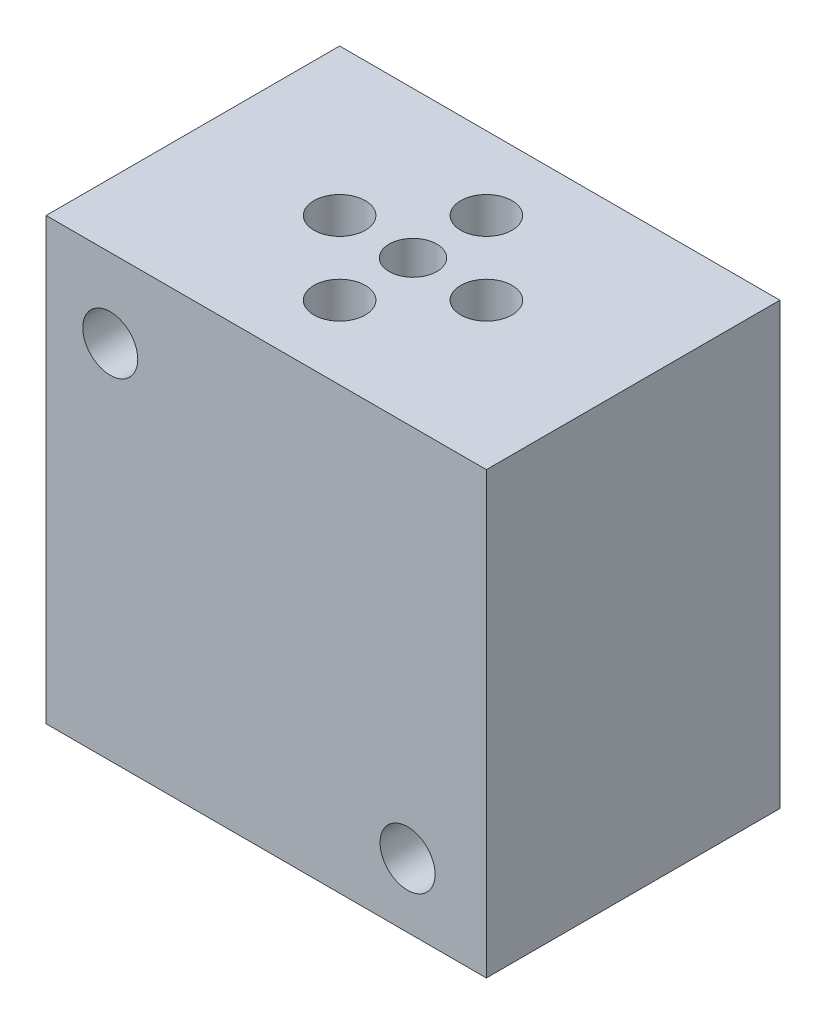
from build123d import *

# Parameters (mm, degrees)
SKETCH3_W           = 76.2
SKETCH3_H           = 50.8
BOSS_EXTRUDE1_DEPTH = 76.2
SKETCH5_R           = 4.1275
CUT_EXTRUDE1_DEPTH  = 76.2
SKETCH6_R           = 4.445
CUT_EXTRUDE2_DEPTH  = 76.2
SKETCH8_R           = 4.445
CUT_EXTRUDE4_DEPTH  = 76.2
SKETCH9_R           = 4.445
CUT_EXTRUDE5_DEPTH  = 76.2
SKETCH10_R          = 4.445
CUT_EXTRUDE6_DEPTH  = 76.2
SKETCH12_R          = 4.7625
CUT_EXTRUDE7_DEPTH  = 76.2
SKETCH13_R          = 4.7625
CUT_EXTRUDE8_DEPTH  = 76.2


with BuildPart() as part:
    # Sketch3 → Boss-Extrude1 (new body)
    with BuildSketch(Plane(origin=(0, 0, 0), x_dir=(1, 0, 0), z_dir=(0, 1, 0))):
        with Locations((-2.241176471, -1.805392157)):
            Rectangle(SKETCH3_W, SKETCH3_H)
    extrude(amount=BOSS_EXTRUDE1_DEPTH)

    # Sketch5 → Cut-Extrude1 (cut)
    with BuildSketch(Plane(origin=(0, 76.2, 0), x_dir=(1, 0, 0), z_dir=(0, 1, 0))):
        with Locations(Location((-2.241176471, -1.805392157, 0), (0, 0, 270))):
            Circle(SKETCH5_R)
    extrude(amount=-CUT_EXTRUDE1_DEPTH, mode=Mode.SUBTRACT)

    # Sketch6 → Cut-Extrude2 (cut)
    with BuildSketch(Plane(origin=(0, 76.2, 0), x_dir=(1, 0, 0), z_dir=(0, 1, 0))):
        with Locations(Location((-14.941176471, -1.805392157, 0), (0, 0, 270))):
            Circle(SKETCH6_R)
    extrude(amount=-CUT_EXTRUDE2_DEPTH, mode=Mode.SUBTRACT)

    # Sketch8 → Cut-Extrude4 (cut)
    with BuildSketch(Plane(origin=(0, 76.2, 0), x_dir=(1, 0, 0), z_dir=(0, 1, 0))):
        with Locations(Location((10.458823529, -1.805392157, 0), (0, 0, 270))):
            Circle(SKETCH8_R)
    extrude(amount=-CUT_EXTRUDE4_DEPTH, mode=Mode.SUBTRACT)

    # Sketch9 → Cut-Extrude5 (cut)
    with BuildSketch(Plane(origin=(0, 76.2, 0), x_dir=(1, 0, 0), z_dir=(0, 1, 0))):
        with Locations(Location((-2.241176471, -14.505392157, 0), (0, 0, 270))):
            Circle(SKETCH9_R)
    extrude(amount=-CUT_EXTRUDE5_DEPTH, mode=Mode.SUBTRACT)

    # Sketch10 → Cut-Extrude6 (cut)
    with BuildSketch(Plane(origin=(0, 76.2, 0), x_dir=(1, 0, 0), z_dir=(0, 1, 0))):
        with Locations(Location((-2.241176471, 10.894607843, 0), (0, 0, 270))):
            Circle(SKETCH10_R)
    extrude(amount=-CUT_EXTRUDE6_DEPTH, mode=Mode.SUBTRACT)

    # Sketch12 → Cut-Extrude7 (cut)
    with BuildSketch(Plane.XY.offset(27.205392157)):
        with Locations((-29.241376471, 62.5602)):
            Circle(SKETCH12_R)
    extrude(amount=-CUT_EXTRUDE7_DEPTH, mode=Mode.SUBTRACT)

    # Sketch13 → Cut-Extrude8 (cut)
    with BuildSketch(Plane.XY.offset(27.205392157)):
        with Locations((22.219023529, 11.0998)):
            Circle(SKETCH13_R)
    extrude(amount=-CUT_EXTRUDE8_DEPTH, mode=Mode.SUBTRACT)


solid = part.part
